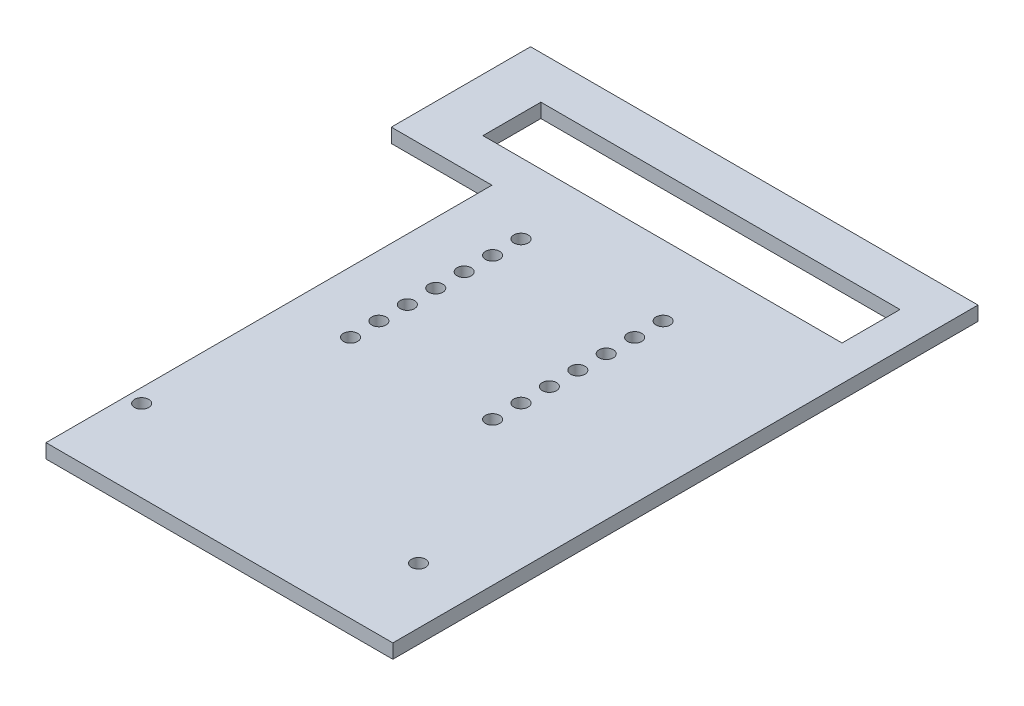
from build123d import *

# Parameters (mm, degrees)
BOSS_EXTRUDE1_DEPTH = 3.175
SKETCH2_R           = 1.5875
SKETCH2_W           = 80.264
SKETCH2_H           = 12.954
CUT_EXTRUDE1_DEPTH  = 223.985606318
SKETCH7_R           = 1.5875
SKETCH7_W           = 46.99
SKETCH7_H           = 138.43
CUT_EXTRUDE4_DEPTH  = 223.985606318
CUT_EXTRUDE5_DEPTH  = 223.985606318
CUT_EXTRUDE8_DEPTH  = 221.482742149
SKETCH10_W          = 220.910927054
SKETCH10_H          = 122.260722121
CUT_EXTRUDE9_DEPTH  = 151.553414525


with BuildPart() as part:
    # Sketch1 → Boss-Extrude1 (new body)
    with BuildSketch(Plane(origin=(0, 0, 0), x_dir=(1, 0, 0), z_dir=(0, 1, 0))):
        with BuildLine():
            Line((-80, 112.5), (100, 112.5))
            Line((100, 112.5), (100, -112.5))
            Line((100, -112.5), (-80, -112.5))
            ThreePointArc((-80, -112.5), (-192.5, 0), (-80, 112.5))
        make_face()
    extrude(amount=-BOSS_EXTRUDE1_DEPTH)

    # Sketch2 → Cut-Extrude1 (cut, through all)
    with BuildSketch(Plane(origin=(0, 0, 0), x_dir=(1, 0, 0), z_dir=(0, 1, 0))):
        with Locations(Location((36.144045702, -74.2188, 0), (0, 0, 270))):
            Circle(SKETCH2_R)
        with Locations(Location((36.144045702, -67.8688, 0), (0, 0, 270))):
            Circle(SKETCH2_R)
        with Locations(Location((36.144045702, -61.5188, 0), (0, 0, 270))):
            Circle(SKETCH2_R)
        with Locations(Location((36.144045702, -55.1688, 0), (0, 0, 270))):
            Circle(SKETCH2_R)
        with Locations(Location((36.144045702, -48.8188, 0), (0, 0, 270))):
            Circle(SKETCH2_R)
        with Locations(Location((36.144045702, -42.4688, 0), (0, 0, 270))):
            Circle(SKETCH2_R)
        with Locations(Location((36.144045702, -36.1188, 0), (0, 0, 270))):
            Circle(SKETCH2_R)
        with Locations(Location((67.894045702, -74.2188, 0), (0, 0, 270))):
            Circle(SKETCH2_R)
        with Locations(Location((67.894045702, -67.8688, 0), (0, 0, 270))):
            Circle(SKETCH2_R)
        with Locations(Location((67.894045702, -61.5188, 0), (0, 0, 270))):
            Circle(SKETCH2_R)
        with Locations(Location((67.894045702, -55.1688, 0), (0, 0, 270))):
            Circle(SKETCH2_R)
        with Locations(Location((67.894045702, -48.8188, 0), (0, 0, 270))):
            Circle(SKETCH2_R)
        with Locations(Location((67.894045702, -42.4688, 0), (0, 0, 270))):
            Circle(SKETCH2_R)
        with Locations(Location((67.894045702, -36.1188, 0), (0, 0, 270))):
            Circle(SKETCH2_R)
        with Locations(Location((36.144045702, 74.2188, 0), (0, 0, 270))):
            Circle(SKETCH2_R)
        with Locations(Location((36.144045702, 67.8688, 0), (0, 0, 270))):
            Circle(SKETCH2_R)
        with Locations(Location((36.144045702, 61.5188, 0), (0, 0, 270))):
            Circle(SKETCH2_R)
        with Locations(Location((36.144045702, 55.1688, 0), (0, 0, 270))):
            Circle(SKETCH2_R)
        with Locations(Location((36.144045702, 48.8188, 0), (0, 0, 270))):
            Circle(SKETCH2_R)
        with Locations(Location((36.144045702, 42.4688, 0), (0, 0, 270))):
            Circle(SKETCH2_R)
        with Locations(Location((36.144045702, 36.1188, 0), (0, 0, 270))):
            Circle(SKETCH2_R)
        with Locations(Location((67.894045702, 74.2188, 0), (0, 0, 270))):
            Circle(SKETCH2_R)
        with Locations(Location((67.894045702, 67.8688, 0), (0, 0, 270))):
            Circle(SKETCH2_R)
        with Locations(Location((67.894045702, 61.5188, 0), (0, 0, 270))):
            Circle(SKETCH2_R)
        with Locations(Location((67.894045702, 55.1688, 0), (0, 0, 270))):
            Circle(SKETCH2_R)
        with Locations(Location((67.894045702, 48.8188, 0), (0, 0, 270))):
            Circle(SKETCH2_R)
        with Locations(Location((67.894045702, 42.4688, 0), (0, 0, 270))):
            Circle(SKETCH2_R)
        with Locations(Location((67.894045702, 36.1188, 0), (0, 0, 270))):
            Circle(SKETCH2_R)
        with Locations((52.019045702, -96.4438)):
            Rectangle(SKETCH2_W, SKETCH2_H)
        with Locations((52.019045702, 96.4438)):
            Rectangle(SKETCH2_W, SKETCH2_H)
    extrude(amount=-CUT_EXTRUDE1_DEPTH, mode=Mode.SUBTRACT)

    # Sketch7 → Cut-Extrude4 (cut, through all)
    with BuildSketch(Plane(origin=(0, 0, 0), x_dir=(1, 0, 0), z_dir=(0, 1, 0))):
        with Locations(Location((-50.166143469, 0, 0), (0, 0, 270))):
            Circle(SKETCH7_R)
        with Locations(Location((25.582761582, 0, 0), (0, 0, 270))):
            Circle(SKETCH7_R)
        with Locations(Location((87.462148806, 0, 0), (0, 0, 270))):
            Circle(SKETCH7_R)
        with Locations((-13.971143469, 0)):
            Rectangle(SKETCH7_W, SKETCH7_H)
    extrude(amount=-CUT_EXTRUDE4_DEPTH, mode=Mode.SUBTRACT)

    # Sketch8 → Cut-Extrude5 (cut, through all)
    with BuildSketch(Plane(origin=(0, 0, 0), x_dir=(1, 0, 0), z_dir=(0, 1, 0))):
        with BuildLine():
            Line((-167.0966, 25.4), (-229.776686608, 25.4))
            Line((-229.776686608, 25.4), (-229.776686608, -25.4))
            Line((-229.776686608, -25.4), (-167.0966, -25.4))
            ThreePointArc((-167.0966, -25.4), (-141.6966, 0), (-167.0966, 25.4))
        make_face()
    extrude(amount=-CUT_EXTRUDE5_DEPTH, mode=Mode.SUBTRACT)

    # Sketch9 → Cut-Extrude8 (cut, through all)
    with BuildSketch(Plane(origin=(0, 0, 0), x_dir=(1, 0, 0), z_dir=(0, 1, 0))):
        Polygon((-202.496068311, 81.375621875), (-202.496068311, 118.60629855), (0, 118.60629855), (0, 81.375621875), (22.483592167, 81.375621875), (22.483592167, -78.716287827), (0, -78.716287827), (0, -122.329366217), (-202.496068311, -122.329366217), (-202.496068311, -78.716287827), align=None)
    extrude(amount=-CUT_EXTRUDE8_DEPTH, mode=Mode.SUBTRACT)

    # Sketch10 → Cut-Extrude9 (cut, through all)
    with BuildSketch(Plane(origin=(0, 0, 0), x_dir=(1, 0, 0), z_dir=(0, 1, 0))):
        with Locations((38.526909819, -79.409861337)):
            Rectangle(SKETCH10_W, SKETCH10_H)
    extrude(amount=-CUT_EXTRUDE9_DEPTH, mode=Mode.SUBTRACT)


solid = part.part
